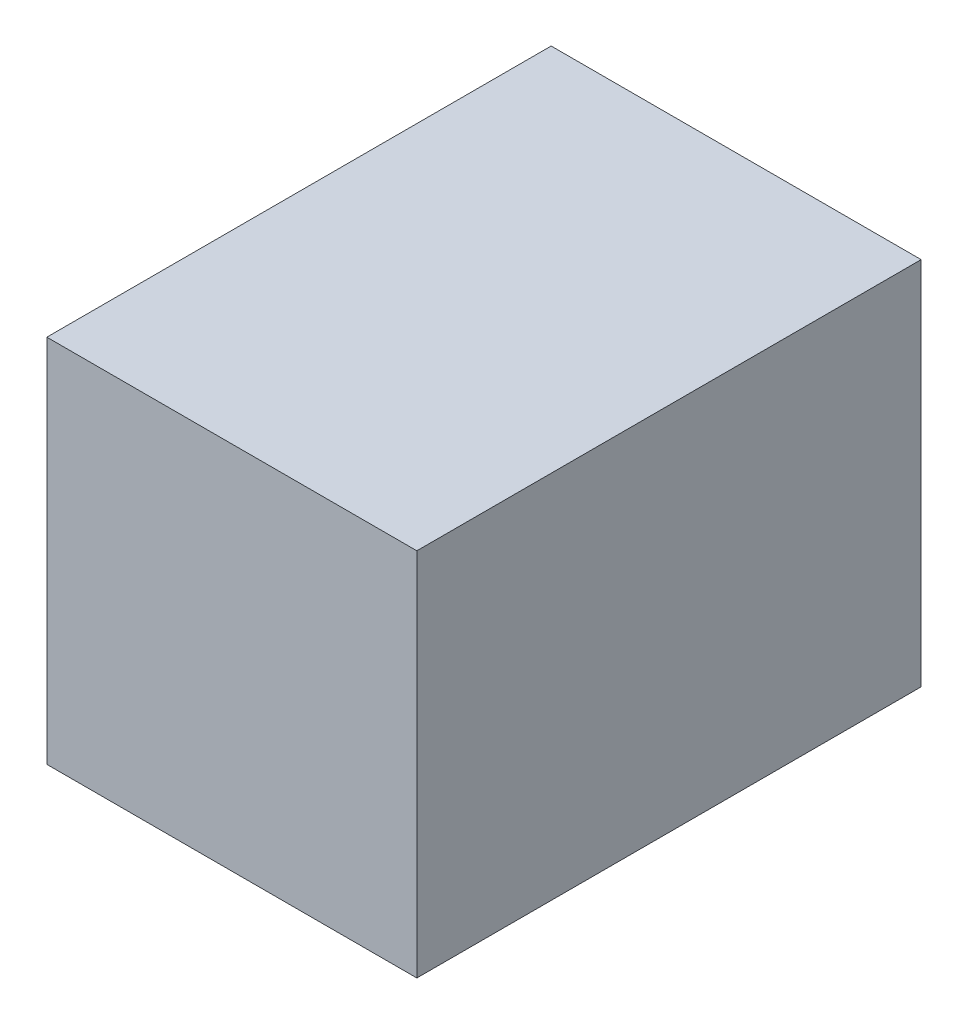
from build123d import *

# Parameters (mm, degrees)
SKETCH1_W           = 57.3
SKETCH1_H           = 57.3
BOSS_EXTRUDE1_DEPTH = 78.1
SKETCH2_R           = 3.175
CUT_EXTRUDE1_DEPTH  = 10


with BuildPart() as part:
    # Sketch1 → Boss-Extrude1 (new body)
    with BuildSketch(Plane.XY):
        Rectangle(SKETCH1_W, SKETCH1_H)
    extrude(amount=BOSS_EXTRUDE1_DEPTH)

    # Sketch2 → Cut-Extrude1 (cut)
    with BuildSketch(Plane(origin=(0, 0, 0), x_dir=(-1, 0, 0), z_dir=(0, 0, -1))):
        Circle(SKETCH2_R)
    extrude(amount=-CUT_EXTRUDE1_DEPTH, mode=Mode.SUBTRACT)


solid = part.part
